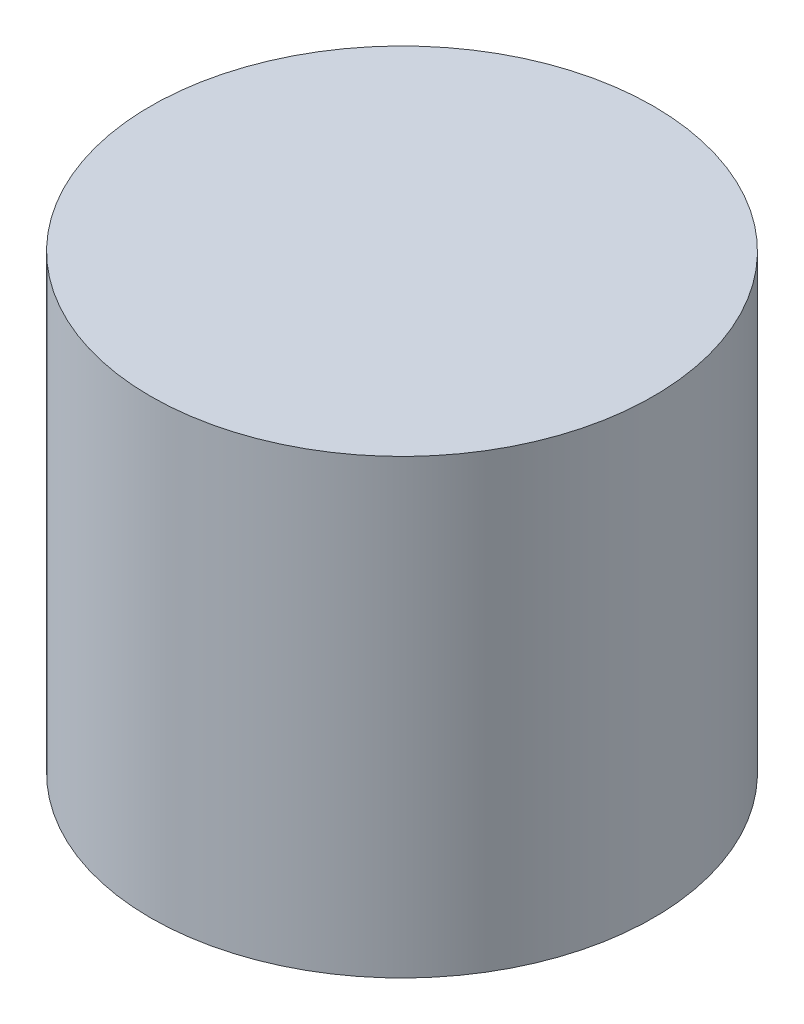
from build123d import *

# Parameters (mm, degrees)
SKETCH1_R           = 5.565
BOSS_EXTRUDE1_DEPTH = 10


with BuildPart() as part:
    # Sketch1 → Boss-Extrude1 (new body)
    with BuildSketch(Plane(origin=(0, 0, 0), x_dir=(1, 0, 0), z_dir=(0, 1, 0))):
        with Locations(Location((0, 0, 0), (0, 0, 270))):
            Circle(SKETCH1_R)
    extrude(amount=BOSS_EXTRUDE1_DEPTH)


solid = part.part
